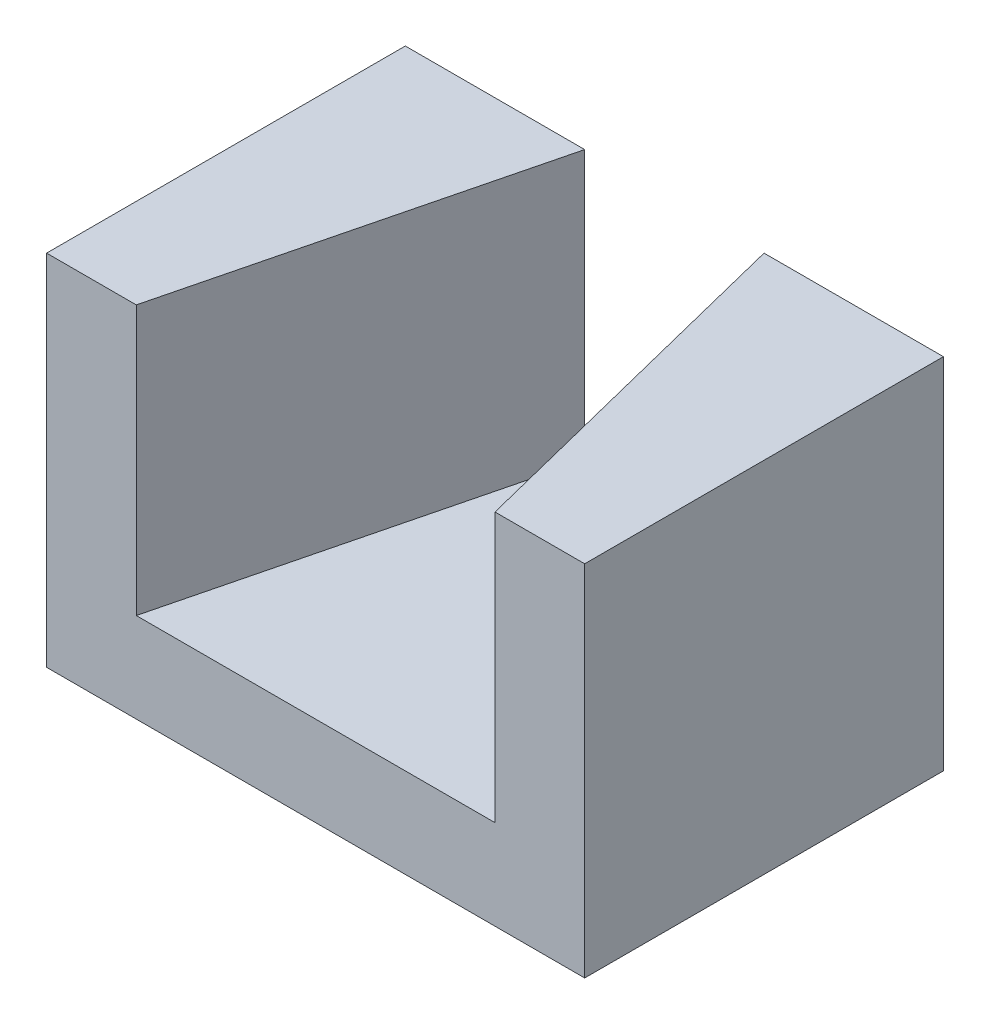
from build123d import *

# Parameters (mm, degrees)
SKETCH_1_W      = 60
SKETCH_1_H      = 40
EXTRUDE_4_DEPTH = 10
EXTRUDE_5_DEPTH = 30


with BuildPart() as part:
    # 草圖1 → 填料-伸長4 (new body)
    with BuildSketch(Plane(origin=(0, 0, 0), x_dir=(1, 0, 0), z_dir=(0, 1, 0))):
        with Locations((30, 20)):
            Rectangle(SKETCH_1_W, SKETCH_1_H)
    extrude(amount=-EXTRUDE_4_DEPTH)

    # 草圖1<7> → 填料-伸長5 (add)
    with BuildSketch(Plane(origin=(0, 0, 0), x_dir=(1, 0, 0), z_dir=(0, 1, 0))):
        Polygon((0, 0), (10, 0), (20, 40), (0, 40), align=None)
        Polygon((40, 40), (50, 0), (60, 0), (60, 40), align=None)
    extrude(amount=EXTRUDE_5_DEPTH)


solid = part.part
